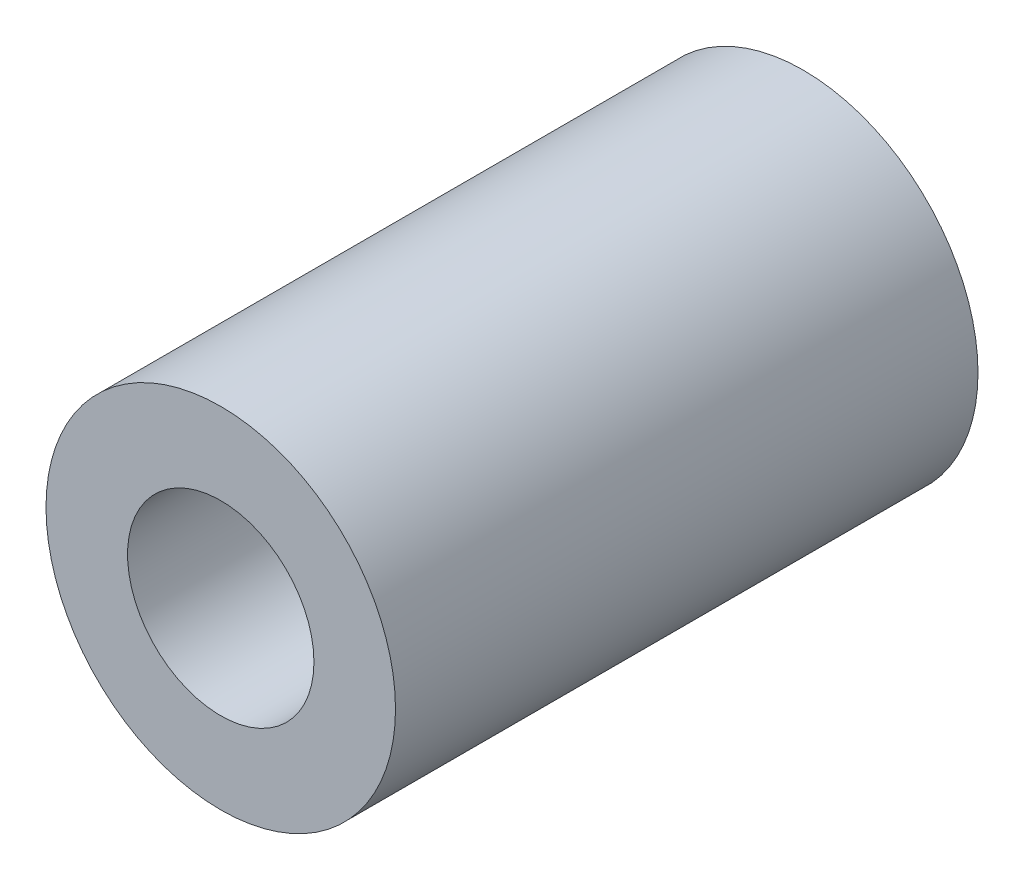
from build123d import *

# Parameters (mm, degrees)
SKETCH_1_R          = 7.5
EXTRUDE_1_DEPTH     = 12.5
SKETCH_2_R          = 3
CUT_EXTRUDE_1_DEPTH = 10
SKETCH_3_R          = 4
CUT_EXTRUDE_2_DEPTH = 9


with BuildPart() as part:
    # 草图1 → 凸台-拉伸1 (new, symmetric)
    with BuildSketch(Plane.XY):
        Circle(SKETCH_1_R)
    extrude(amount=EXTRUDE_1_DEPTH, both=True)

    # 草图2 → 切除-拉伸1 (cut)
    with BuildSketch(Plane(origin=(0, 0, -12.5), x_dir=(-1, 0, 0), z_dir=(0, 0, -1))):
        Circle(SKETCH_2_R)
    extrude(amount=-CUT_EXTRUDE_1_DEPTH, mode=Mode.SUBTRACT)

    # 草图3 → 切除-拉伸2 (cut)
    with BuildSketch(Plane.XY.offset(12.5)):
        Circle(SKETCH_3_R)
    extrude(amount=-CUT_EXTRUDE_2_DEPTH, mode=Mode.SUBTRACT)


solid = part.part
